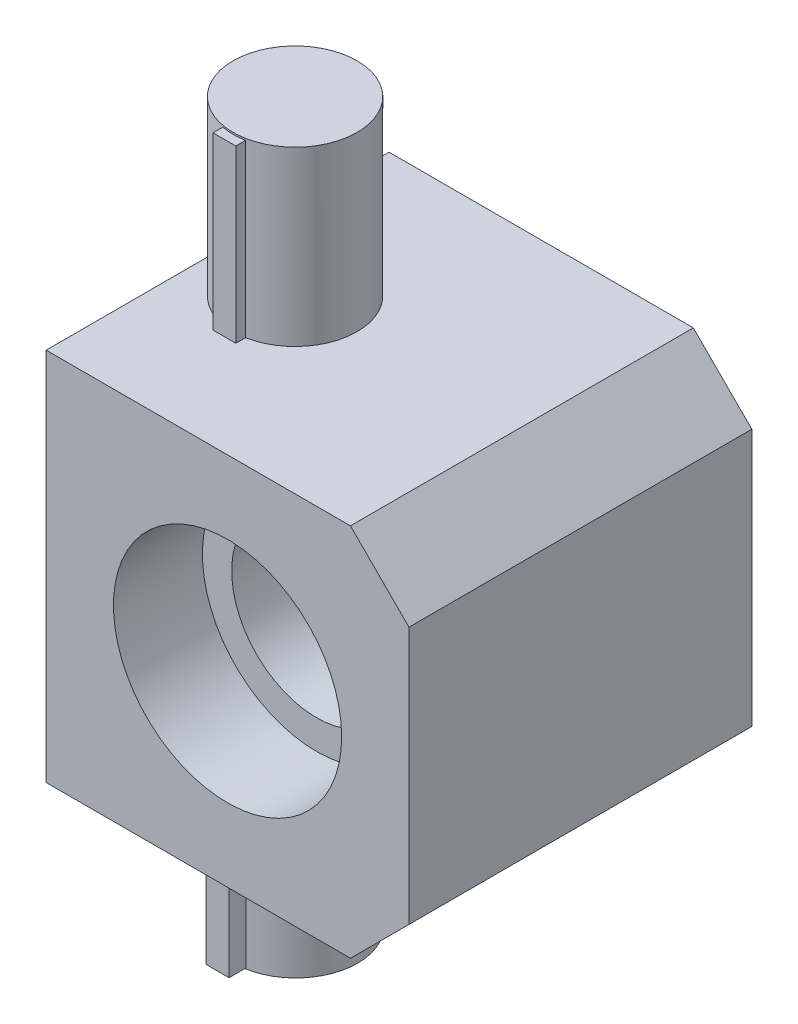
from build123d import *

# Parameters (mm, degrees)
SKETCH2_W           = 6.2
SKETCH2_H           = 6.4
BOSS_EXTRUDE1_DEPTH = 5.86
CHAMFER1_SIZE       = 1
SKETCH5_R           = 1.95
CUT_EXTRUDE3_DEPTH  = 1.52
SKETCH6_R           = 1.45
CUT_EXTRUDE4_DEPTH  = 7.219774916
SKETCH7_R           = 1.06
BOSS_EXTRUDE2_DEPTH = 2.95
SKETCH8_W           = 0.39
SKETCH8_H           = 0.295203358
BOSS_EXTRUDE3_DEPTH = 2.92
SKETCH9_R           = 1.06
BOSS_EXTRUDE4_DEPTH = 2.94
SKETCH11_W          = 0.39
SKETCH11_H          = 0.550473967
BOSS_EXTRUDE5_DEPTH = 2.92


with BuildPart() as part:
    # Sketch2 → Boss-Extrude1 (new body)
    with BuildSketch(Plane.XY):
        Rectangle(SKETCH2_W, SKETCH2_H)
    extrude(amount=BOSS_EXTRUDE1_DEPTH)

    # Chamfer1
    chamfer1_edges = [part.edges().sort_by_distance(p)[0] for p in [
        (3.1, 3.2, 2.93),
        (3.1, -3.2, 2.93),
    ]]
    chamfer(chamfer1_edges, length=CHAMFER1_SIZE)

    # Sketch5 → Cut-Extrude3 (cut)
    with BuildSketch(Plane.XY.offset(5.86)):
        Circle(SKETCH5_R)
    extrude(amount=-CUT_EXTRUDE3_DEPTH, mode=Mode.SUBTRACT)

    # Sketch6 → Cut-Extrude4 (cut, through all)
    with BuildSketch(Plane.XY.offset(4.34)):
        Circle(SKETCH6_R)
    extrude(amount=-CUT_EXTRUDE4_DEPTH, mode=Mode.SUBTRACT)

    # Sketch7 → Boss-Extrude2 (add)
    with BuildSketch(Plane(origin=(0, 3.2, 0), x_dir=(1, 0, 0), z_dir=(0, 1, 0))):
        with Locations(Location((-1.775985432, -2.93, 0), (0, 0, 180))):
            Circle(SKETCH7_R)
    extrude(amount=BOSS_EXTRUDE2_DEPTH)

    # Sketch8 → Boss-Extrude3 (add)
    with BuildSketch(Plane(origin=(0, 3.2, 0), x_dir=(1, 0, 0), z_dir=(0, 1, 0))):
        with Locations((-1.775985432, -3.99)):
            Rectangle(SKETCH8_W, SKETCH8_H)
    extrude(amount=BOSS_EXTRUDE3_DEPTH)

    # Sketch9 → Boss-Extrude4 (add)
    with BuildSketch(Plane.XZ.offset(3.2)):
        with Locations((-1.764050238, 2.930792226)):
            Circle(SKETCH9_R)
    extrude(amount=BOSS_EXTRUDE4_DEPTH)

    # Sketch11 → Boss-Extrude5 (add)
    with BuildSketch(Plane.XZ.offset(3.2)):
        with Locations((-1.764050238, 3.990792225)):
            Rectangle(SKETCH11_W, SKETCH11_H)
    extrude(amount=BOSS_EXTRUDE5_DEPTH)


solid = part.part
